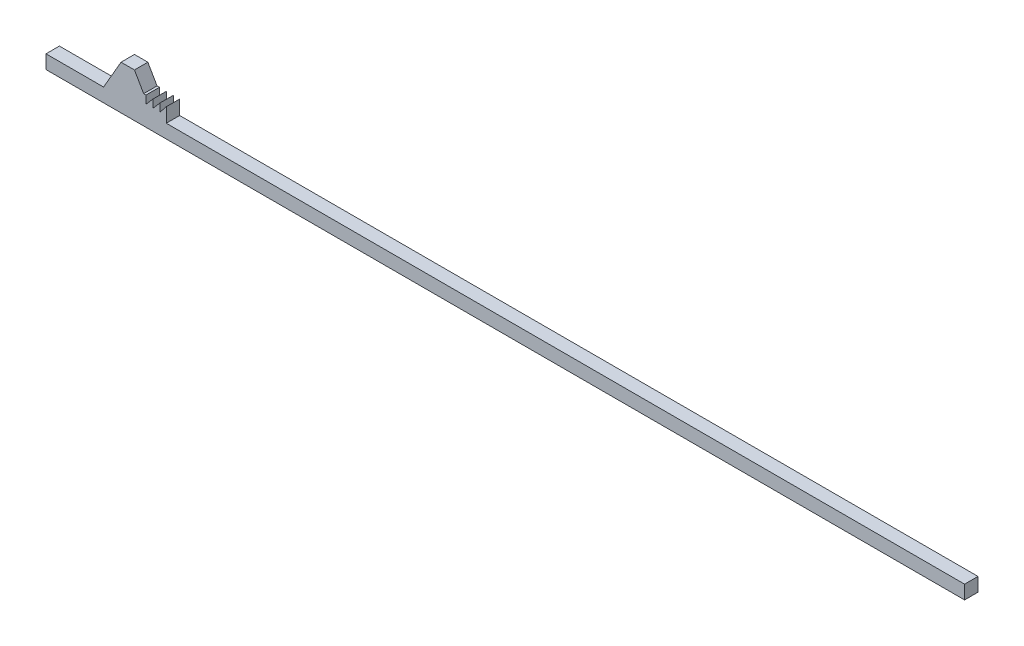
from build123d import *

# Parameters (mm, degrees)
EXTRUDE_1_DEPTH = 5


with BuildPart() as part:
    # Model → 凸台-拉伸1 (new body)
    with BuildSketch(Plane.XY):
        Polygon((614.246138188, 32.484405329), (617.67653772, 26.54277905), (618.559903109, 26.54277905), (618.559903109, 23.568043607), (621.143191819, 26.54277905), (621.143191819, 23.568043607), (623.726480529, 26.54277905), (623.726480529, 23.568043607), (626.111252729, 26.54277905), (626.111252729, 21.209813756), (923.648003194, 21.209813756), (923.648003194, 16.109813756), (581.281303194, 16.109813756), (581.281303194, 21.209813756), (602.736749709, 21.209813756), (609.246138188, 32.484405329), align=None)
    extrude(amount=EXTRUDE_1_DEPTH)


solid = part.part
